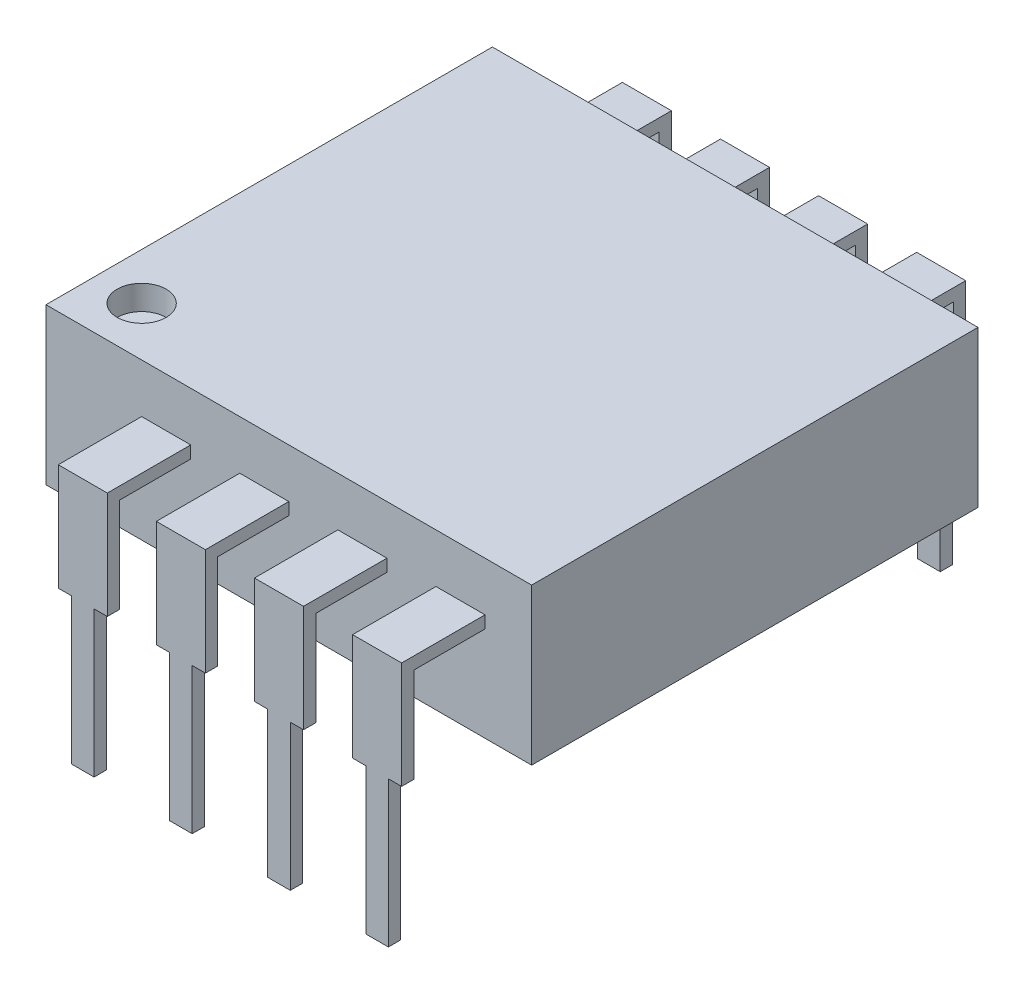
from build123d import *

# Parameters (mm, degrees)
EXTRUDE_1_DEPTH     = 4.95
SKETCH_2_R          = 0.5
CUT_EXTRUDE_1_DEPTH = 0.5
CUT_EXTRUDE_2_REACH = 16.197
CUT_EXTRUDE_3_REACH = 16.197
SKETCH_5_R          = 2.8
SKETCH_5_R_2        = 0.4
EXTRUDE_2_DEPTH     = 1.42
CHAMFER_1_SIZE      = 0.5
CHAMFER_1_SIZE2     = 0.466257543


with BuildPart() as part:
    # Эскиз1 → Бобышка-Вытянуть1 (new, symmetric)
    with BuildSketch(Plane(origin=(0, 0, 0), x_dir=(0, 0, -1), z_dir=(1, 0, 0))):
        Polygon((0, 1.59), (-4.55, 1.59), (-4.55, 0.59), (-4.55, 0.34), (-4.55, -1.59), (0, -1.59), align=None)
        Polygon((4.55, 1.59), (0, 1.59), (0, -1.59), (4.55, -1.59), (4.55, 0.34), (4.55, 0.59), align=None)
        Polygon((-4.55, 0.34), (-4.55, 0.59), (-6.25, 0.59), (-6.25, -4.56), (-6, -4.56), (-6, 0.34), align=None)
        Polygon((6.25, 0.59), (4.55, 0.59), (4.55, 0.34), (6, 0.34), (6, -4.56), (6.25, -4.56), align=None)
    extrude(amount=EXTRUDE_1_DEPTH, both=True)

    # Эскиз2 → Вырез-Вытянуть1 (cut)
    with BuildSketch(Plane(origin=(0, 1.59, 0), x_dir=(1, 0, 0), z_dir=(0, 1, 0))):
        with Locations(Location((-4, -3.55, 0), (0, 0, 270))):
            Circle(SKETCH_2_R)
    extrude(amount=-CUT_EXTRUDE_1_DEPTH, mode=Mode.SUBTRACT)

    # Вырез-Вытянуть2: up to this face of the body (flat: up to its plane)
    cut_extrude_2_end = Plane(part.part.faces().sort_by_distance((0, -0.625, 4.55))[0])
    # Эскиз3 → Вырез-Вытянуть2 (cut, up to the picked face)
    with BuildSketch(Plane.XY.offset(6.25), mode=Mode.PRIVATE) as cut_extrude_2_sk1:
        Polygon((-3, -1.59), (-3, 0.59), (-4.95, 0.59), (-4.95, -4.56), (-2.73, -4.56), (-2.73, -1.59), align=None)
    cut_extrude_2_tool1 = split(extrude(cut_extrude_2_sk1.sketch, amount=-CUT_EXTRUDE_2_REACH, mode=Mode.PRIVATE), bisect_by=cut_extrude_2_end, keep=Keep.BOTH, mode=Mode.PRIVATE)
    # Эскиз3 → Вырез-Вытянуть2 (cut, up to the picked face)
    with BuildSketch(Plane.XY.offset(6.25), mode=Mode.PRIVATE) as cut_extrude_2_sk2:
        Polygon((-1, 0.59), (-2, 0.59), (-2, -1.59), (-2.27, -1.59), (-2.27, -4.56), (-0.73, -4.56), (-0.73, -1.59), (-1, -1.59), align=None)
    cut_extrude_2_tool2 = split(extrude(cut_extrude_2_sk2.sketch, amount=-CUT_EXTRUDE_2_REACH, mode=Mode.PRIVATE), bisect_by=cut_extrude_2_end, keep=Keep.BOTH, mode=Mode.PRIVATE)
    # Эскиз3 → Вырез-Вытянуть2 (cut, up to the picked face)
    with BuildSketch(Plane.XY.offset(6.25), mode=Mode.PRIVATE) as cut_extrude_2_sk3:
        Polygon((1, 0.59), (0, 0.59), (0, -1.59), (-0.27, -1.59), (-0.27, -4.56), (1.27, -4.56), (1.27, -1.59), (1, -1.59), align=None)
    cut_extrude_2_tool3 = split(extrude(cut_extrude_2_sk3.sketch, amount=-CUT_EXTRUDE_2_REACH, mode=Mode.PRIVATE), bisect_by=cut_extrude_2_end, keep=Keep.BOTH, mode=Mode.PRIVATE)
    # Эскиз3 → Вырез-Вытянуть2 (cut, up to the picked face)
    with BuildSketch(Plane.XY.offset(6.25), mode=Mode.PRIVATE) as cut_extrude_2_sk4:
        Polygon((3, 0.59), (2, 0.59), (2, -1.59), (1.73, -1.59), (1.73, -4.56), (3.27, -4.56), (3.27, -1.59), (3, -1.59), align=None)
    cut_extrude_2_tool4 = split(extrude(cut_extrude_2_sk4.sketch, amount=-CUT_EXTRUDE_2_REACH, mode=Mode.PRIVATE), bisect_by=cut_extrude_2_end, keep=Keep.BOTH, mode=Mode.PRIVATE)
    # Эскиз3 → Вырез-Вытянуть2 (cut, up to the picked face)
    with BuildSketch(Plane.XY.offset(6.25), mode=Mode.PRIVATE) as cut_extrude_2_sk5:
        Polygon((4.95, 0.59), (4, 0.59), (4, -1.59), (3.73, -1.59), (3.73, -4.56), (4.95, -4.56), align=None)
    cut_extrude_2_tool5 = split(extrude(cut_extrude_2_sk5.sketch, amount=-CUT_EXTRUDE_2_REACH, mode=Mode.PRIVATE), bisect_by=cut_extrude_2_end, keep=Keep.BOTH, mode=Mode.PRIVATE)
    add(cut_extrude_2_tool1.solids().sort_by(Axis((-3.89292, -2.065601, 6.25), (0, 0, -1)))[0], mode=Mode.SUBTRACT)
    add(cut_extrude_2_tool2.solids().sort_by(Axis((-1.5, -2.243838, 6.25), (0, 0, -1)))[0], mode=Mode.SUBTRACT)
    add(cut_extrude_2_tool3.solids().sort_by(Axis((0.5, -2.243838, 6.25), (0, 0, -1)))[0], mode=Mode.SUBTRACT)
    add(cut_extrude_2_tool4.solids().sort_by(Axis((2.5, -2.243838, 6.25), (0, 0, -1)))[0], mode=Mode.SUBTRACT)
    add(cut_extrude_2_tool5.solids().sort_by(Axis((4.389098, -2.138497, 6.25), (0, 0, -1)))[0], mode=Mode.SUBTRACT)

    # Вырез-Вытянуть3: up to this face of the body (flat: up to its plane)
    cut_extrude_3_end = Plane(part.part.faces().sort_by_distance((0, -0.625, -4.55))[0])
    # Эскиз4 → Вырез-Вытянуть3 (cut, up to the picked face)
    with BuildSketch(Plane(origin=(0, 0, -6.25), x_dir=(-1, 0, 0), z_dir=(0, 0, -1)), mode=Mode.PRIVATE) as cut_extrude_3_sk1:
        Polygon((-3, -1.59), (-3, 0.59), (-4.95, 0.59), (-4.95, -4.56), (-2.73, -4.56), (-2.73, -1.59), align=None)
    cut_extrude_3_tool1 = split(extrude(cut_extrude_3_sk1.sketch, amount=-CUT_EXTRUDE_3_REACH, mode=Mode.PRIVATE), bisect_by=cut_extrude_3_end, keep=Keep.BOTH, mode=Mode.PRIVATE)
    # Эскиз4 → Вырез-Вытянуть3 (cut, up to the picked face)
    with BuildSketch(Plane(origin=(0, 0, -6.25), x_dir=(-1, 0, 0), z_dir=(0, 0, -1)), mode=Mode.PRIVATE) as cut_extrude_3_sk2:
        Polygon((-1, 0.59), (-2, 0.59), (-2, -1.59), (-2.27, -1.59), (-2.27, -4.56), (-0.73, -4.56), (-0.73, -1.59), (-1, -1.59), align=None)
    cut_extrude_3_tool2 = split(extrude(cut_extrude_3_sk2.sketch, amount=-CUT_EXTRUDE_3_REACH, mode=Mode.PRIVATE), bisect_by=cut_extrude_3_end, keep=Keep.BOTH, mode=Mode.PRIVATE)
    # Эскиз4 → Вырез-Вытянуть3 (cut, up to the picked face)
    with BuildSketch(Plane(origin=(0, 0, -6.25), x_dir=(-1, 0, 0), z_dir=(0, 0, -1)), mode=Mode.PRIVATE) as cut_extrude_3_sk3:
        Polygon((1, 0.59), (0, 0.59), (0, -1.59), (-0.27, -1.59), (-0.27, -4.56), (1.27, -4.56), (1.27, -1.59), (1, -1.59), align=None)
    cut_extrude_3_tool3 = split(extrude(cut_extrude_3_sk3.sketch, amount=-CUT_EXTRUDE_3_REACH, mode=Mode.PRIVATE), bisect_by=cut_extrude_3_end, keep=Keep.BOTH, mode=Mode.PRIVATE)
    # Эскиз4 → Вырез-Вытянуть3 (cut, up to the picked face)
    with BuildSketch(Plane(origin=(0, 0, -6.25), x_dir=(-1, 0, 0), z_dir=(0, 0, -1)), mode=Mode.PRIVATE) as cut_extrude_3_sk4:
        Polygon((3, 0.59), (2, 0.59), (2, -1.59), (1.73, -1.59), (1.73, -4.56), (3.27, -4.56), (3.27, -1.59), (3, -1.59), align=None)
    cut_extrude_3_tool4 = split(extrude(cut_extrude_3_sk4.sketch, amount=-CUT_EXTRUDE_3_REACH, mode=Mode.PRIVATE), bisect_by=cut_extrude_3_end, keep=Keep.BOTH, mode=Mode.PRIVATE)
    # Эскиз4 → Вырез-Вытянуть3 (cut, up to the picked face)
    with BuildSketch(Plane(origin=(0, 0, -6.25), x_dir=(-1, 0, 0), z_dir=(0, 0, -1)), mode=Mode.PRIVATE) as cut_extrude_3_sk5:
        Polygon((4.95, 0.59), (4, 0.59), (4, -1.59), (3.73, -1.59), (3.73, -4.56), (4.95, -4.56), align=None)
    cut_extrude_3_tool5 = split(extrude(cut_extrude_3_sk5.sketch, amount=-CUT_EXTRUDE_3_REACH, mode=Mode.PRIVATE), bisect_by=cut_extrude_3_end, keep=Keep.BOTH, mode=Mode.PRIVATE)
    add(cut_extrude_3_tool1.solids().sort_by(Axis((3.89292, -2.065601, -6.25), (0, 0, 1)))[0], mode=Mode.SUBTRACT)
    add(cut_extrude_3_tool2.solids().sort_by(Axis((1.5, -2.243838, -6.25), (0, 0, 1)))[0], mode=Mode.SUBTRACT)
    add(cut_extrude_3_tool3.solids().sort_by(Axis((-0.5, -2.243838, -6.25), (0, 0, 1)))[0], mode=Mode.SUBTRACT)
    add(cut_extrude_3_tool4.solids().sort_by(Axis((-2.5, -2.243838, -6.25), (0, 0, 1)))[0], mode=Mode.SUBTRACT)
    add(cut_extrude_3_tool5.solids().sort_by(Axis((-4.389098, -2.138497, -6.25), (0, 0, 1)))[0], mode=Mode.SUBTRACT)

    # Эскиз5 → Бобышка-Вытянуть2 (add)
    with BuildSketch(Plane.XZ.offset(1.59)):
        with Locations(Location((-0.5, 0, 0), (0, 0, 90))):
            Circle(SKETCH_5_R)
        with Locations(Location((-0.5, 0, 0), (0, 0, 270))):
            Circle(SKETCH_5_R_2, mode=Mode.SUBTRACT)
    extrude(amount=EXTRUDE_2_DEPTH)

    # Фаска1
    chamfer_1_edges = [part.edges().sort_by_distance(p)[0] for p in [
        (-0.5, -3.01, -2.8),
    ]]
    chamfer_1_side = [part.faces().sort_by_distance(p)[0] for p in [
        (-0.5, -2.3, -2.8),
    ]]
    chamfer(chamfer_1_edges, length=CHAMFER_1_SIZE, length2=CHAMFER_1_SIZE2, reference=chamfer_1_side[0])


solid = part.part
